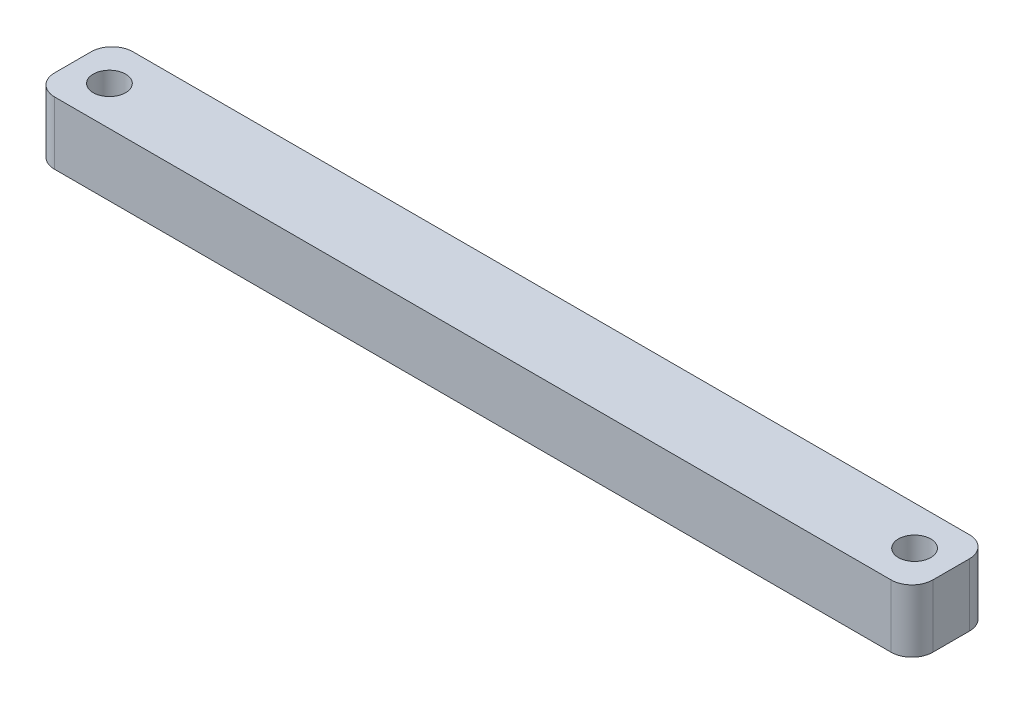
from build123d import *

# Parameters (mm, degrees)
SKETCH1_W           = 84.09
SKETCH1_H           = 7.5
SKETCH1_R           = 1.55
BOSS_EXTRUDE1_DEPTH = 6
FILLET5_R           = 2


with BuildPart() as part:
    # Sketch1 → Boss-Extrude1 (new body)
    with BuildSketch(Plane(origin=(0, 0, 0), x_dir=(1, 0, 0), z_dir=(0, 1, 0))):
        Rectangle(SKETCH1_W, SKETCH1_H)
        with Locations(Location((-38.545, 0, 0), (0, 0, 270))):
            Circle(SKETCH1_R, mode=Mode.SUBTRACT)
        with Locations(Location((38.545, 0, 0), (0, 0, 90))):
            Circle(SKETCH1_R, mode=Mode.SUBTRACT)
    extrude(amount=BOSS_EXTRUDE1_DEPTH)

    # Fillet5
    fillet5_edges = [part.edges().sort_by_distance(p)[0] for p in [
        (42.045, 3, 3.75),
        (-42.045, 3, 3.75),
        (-42.045, 3, -3.75),
        (42.045, 3, -3.75),
    ]]
    fillet(fillet5_edges, radius=FILLET5_R)


solid = part.part
